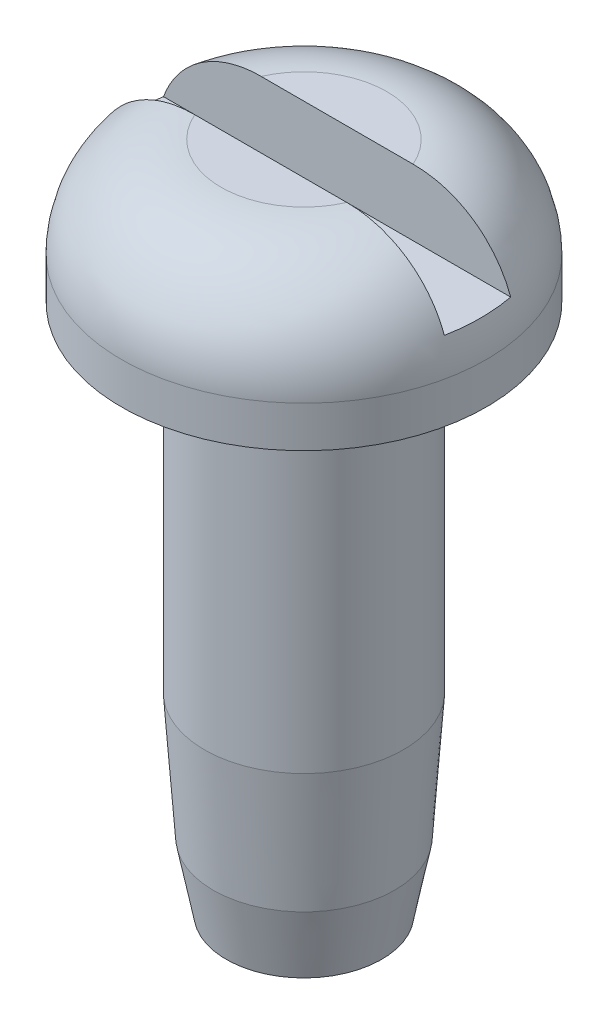
from build123d import *

# Parameters (mm, degrees)
SKETCH_2_W          = 1
SKETCH_2_H          = 1
CUT_EXTRUDE_1_DEPTH = 5


with BuildPart() as part:
    # Эскиз1 → Повернуть1 (revolve)
    with BuildSketch(Plane.XY, mode=Mode.PRIVATE) as revolve_1_sk:
        with BuildLine():
            Line((0, 0), (0, 10.12))
            Line((0, 10.12), (1.25, 10.12))
            ThreePointArc((1.25, 10.12), (2.310660172, 9.680660172), (2.75, 8.62))
            Line((2.75, 8.62), (2.75, 8))
            Line((2.75, 8), (1.5, 8))
            Line((1.5, 8), (1.5, 2.9))
            Line((1.5, 2.9), (1.367139057, 1))
            Line((1.367139057, 1), (1.172758748, 0))
            Line((1.172758748, 0), (0, 0))
        make_face()
    revolve(revolve_1_sk.sketch.rotate(Axis((0, 0, 0), (0, 1, 0)), 90), axis=Axis((0, 0, 0), (0, 1, 0)))

    # Эскиз2 → Вырез-Вытянуть1 (cut, symmetric)
    with BuildSketch(Plane(origin=(0, 0, 0), x_dir=(0, 0, -1), z_dir=(1, 0, 0))):
        with Locations((0, 9.62)):
            Rectangle(SKETCH_2_W, SKETCH_2_H)
    extrude(amount=CUT_EXTRUDE_1_DEPTH, both=True, mode=Mode.SUBTRACT)


solid = part.part
